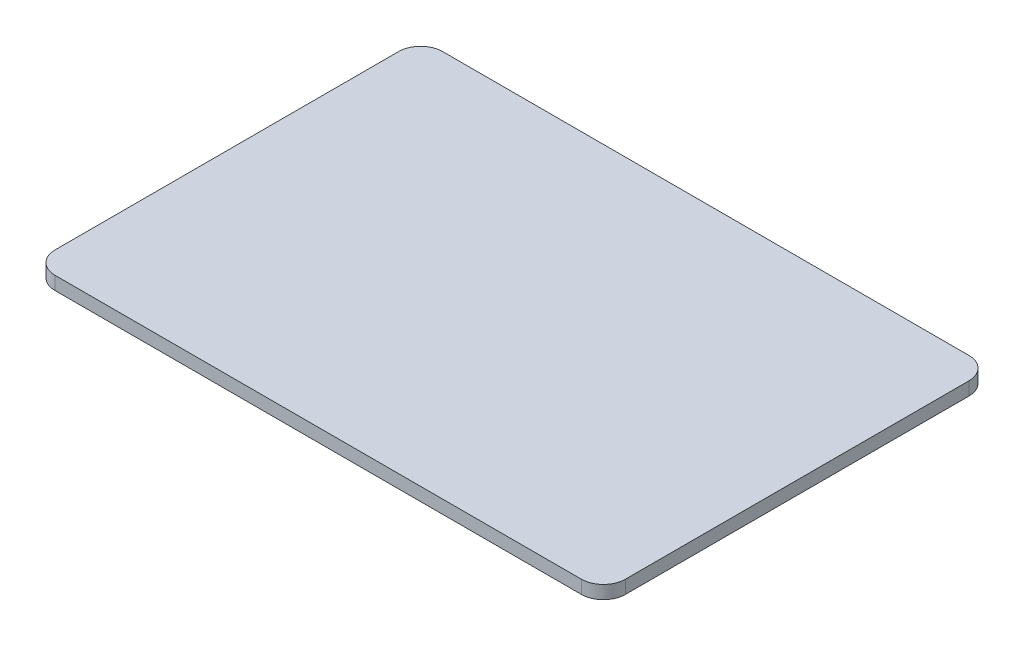
from build123d import *

# Parameters (mm, degrees)
SKETCH1_W           = 259
SKETCH1_H           = 176
BOSS_EXTRUDE1_DEPTH = 6
FILLET1_R           = 10


with BuildPart() as part:
    # Sketch1 → Boss-Extrude1 (new body)
    with BuildSketch(Plane(origin=(0, 0, 0), x_dir=(1, 0, 0), z_dir=(0, 1, 0))):
        Rectangle(SKETCH1_W, SKETCH1_H)
    extrude(amount=BOSS_EXTRUDE1_DEPTH)

    # Fillet1
    fillet1_edges = [part.edges().sort_by_distance(p)[0] for p in [
        (129.5, 3, 88),
        (-129.5, 3, 88),
        (-129.5, 3, -88),
        (129.5, 3, -88),
    ]]
    fillet(fillet1_edges, radius=FILLET1_R)


solid = part.part
